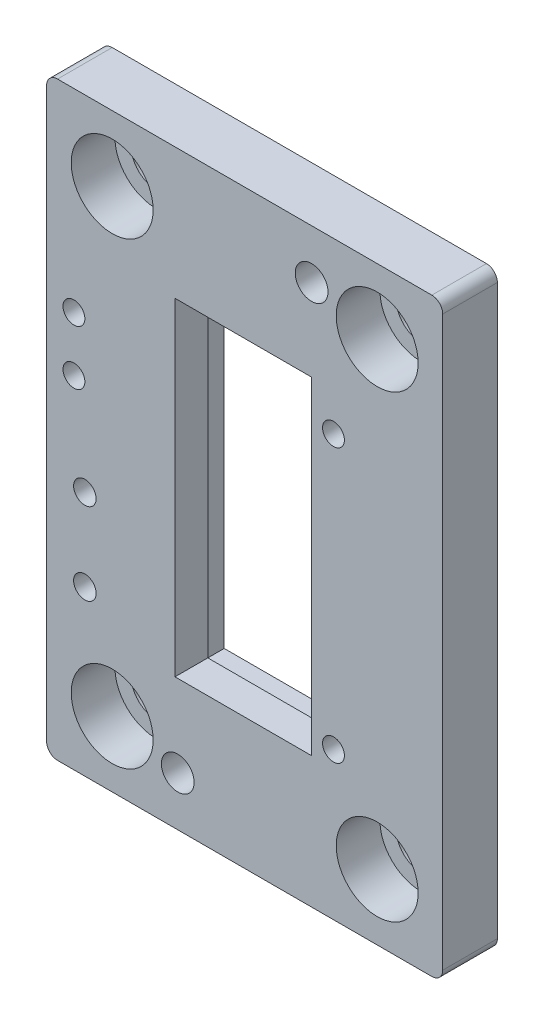
from build123d import *

# Parameters (mm, degrees)
SKETCH1_R                       = 2.06
SKETCH1_W                       = 25
SKETCH1_H                       = 60
BOSS_EXTRUDE1_DEPTH             = 10
CUT_EXTRUDE1_START              = -6
SKETCH2_R                       = 3.06
SKETCH2_W                       = 27
SKETCH2_H                       = 62
CUT_EXTRUDE1_DEPTH              = 4
SKETCH3_R                       = 2
CUT_EXTRUDE2_DEPTH              = 7.5
CBORE_FOR_M8_SHCS1_D            = 9
CBORE_FOR_M8_SHCS1_CBORE_D      = 15
CBORE_FOR_M8_SHCS1_CBORE_DEPTH  = 8
F_6_0MM_CLEARANCE_DOWEL_HOLE1_D = 6


with BuildPart() as part:
    # Sketch1 → Boss-Extrude1 (new body)
    with BuildSketch(Plane.XY):
        with BuildLine():
            Line((22, 52), (22, -52))
            ThreePointArc((22, -52), (22.585786438, -53.414213562), (24, -54))
            Line((24, -54), (36, -54))
            Line((36, -54), (92.5, -54))
            ThreePointArc((92.5, -54), (93.914213562, -53.414213562), (94.5, -52))
            Line((94.5, -52), (94.5, 52))
            ThreePointArc((94.5, 52), (93.914213562, 53.414213562), (92.5, 54))
            Line((92.5, 54), (24, 54))
            ThreePointArc((24, 54), (22.585786438, 53.414213562), (22, 52))
        make_face()
        with Locations((29, -24)):
            Circle(SKETCH1_R, mode=Mode.SUBTRACT)
        with Locations((29, -9)):
            Circle(SKETCH1_R, mode=Mode.SUBTRACT)
        with Locations((58, 0)):
            Rectangle(SKETCH1_W, SKETCH1_H, mode=Mode.SUBTRACT)
    extrude(amount=-BOSS_EXTRUDE1_DEPTH)

    # Sketch2 → Cut-Extrude1 (cut)
    with BuildSketch(Plane.XY.offset(CUT_EXTRUDE1_START)):
        with Locations((29, -9)):
            Circle(SKETCH2_R)
        with Locations((29, -24)):
            Circle(SKETCH2_R)
        with Locations((58, 0)):
            Rectangle(SKETCH2_W, SKETCH2_H)
    extrude(amount=-CUT_EXTRUDE1_DEPTH, mode=Mode.SUBTRACT)

    # Sketch3 → Cut-Extrude2 (cut)
    with BuildSketch(Plane.XY):
        with Locations((27, 8.5)):
            Circle(SKETCH3_R)
        with Locations((27, 18.5)):
            Circle(SKETCH3_R)
        with Locations((74.5, 23)):
            Circle(SKETCH3_R)
        with Locations((74.5, -27)):
            Circle(SKETCH3_R)
    extrude(amount=-CUT_EXTRUDE2_DEPTH, mode=Mode.SUBTRACT)

    # CBORE for M8 SHCS1 (through all)
    with Locations(Plane(origin=(0, 0, 0), x_dir=(0.9063077870366375, -0.4226182617407263, 0), z_dir=(0, 0, 1))):
        with Locations((57.020425437, 72.930933649), (13.064497766, 52.433947955), (48.564431752, -23.695906156), (92.520359424, -3.198920462)):
            CounterBoreHole(CBORE_FOR_M8_SHCS1_D / 2, CBORE_FOR_M8_SHCS1_CBORE_D / 2, CBORE_FOR_M8_SHCS1_CBORE_DEPTH)

    # Ø6.0mm Clearance Dowel Hole1 (through all)
    with Locations(Plane(origin=(0, 0, 0), x_dir=(0.9063077870366375, -0.4226182617407263, 0), z_dir=(0, 0, 1))):
        with Locations((44.876877208, 70.578437869), (60.707979982, -21.343410377)):
            Hole(F_6_0MM_CLEARANCE_DOWEL_HOLE1_D / 2)


solid = part.part
